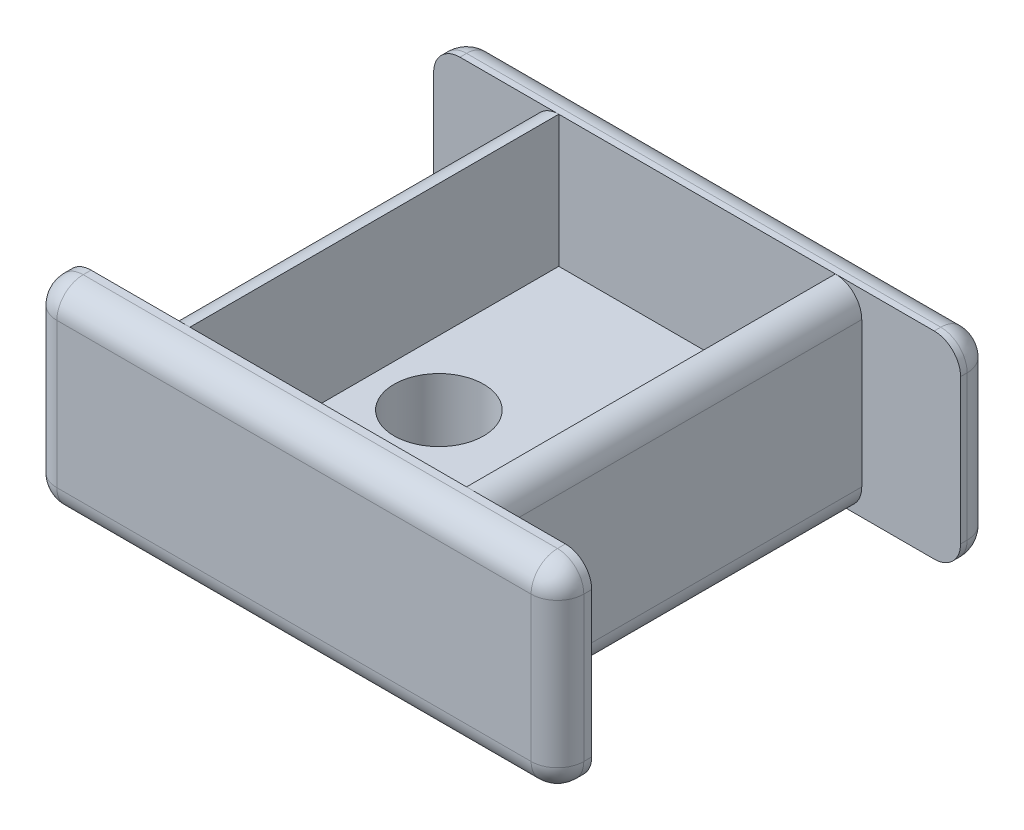
from build123d import *

# Parameters (mm, degrees)
BOSS_EXTRUDE1_DEPTH = 19.05
SKETCH4_R           = 4.064
SKETCH4_R_2         = 4.318
CUT_EXTRUDE3_DEPTH  = 38.1
FILLET8_R           = 2.54
FILLET9_R           = 2.54
SKETCH9_W           = 26.67
SKETCH9_H           = 35.56
CUT_EXTRUDE6_DEPTH  = 12.7
BOSS_EXTRUDE2_DEPTH = 0.254


with BuildPart() as part:
    # Sketch1 → Boss-Extrude1 (new body)
    with BuildSketch(Plane(origin=(0, 0, 0), x_dir=(1, 0, 0), z_dir=(0, 1, 0))):
        Polygon((25.4, 20.955), (-25.4, 20.955), (-25.4, 17.78), (-15.875, 17.78), (-15.875, -17.78), (-25.4, -17.78), (-25.4, -21.082), (25.4, -21.082), (25.4, -17.78), (15.875, -17.78), (15.875, 17.78), (25.4, 17.78), align=None)
    extrude(amount=BOSS_EXTRUDE1_DEPTH)

    # Sketch4 → Cut-Extrude3 (cut)
    with BuildSketch(Plane(origin=(0, 19.05, 0), x_dir=(1, 0, 0), z_dir=(0, 1, 0))):
        with Locations(Location((6.985, 0, 0), (0, 0, 270))):
            Circle(SKETCH4_R)
        with Locations(Location((-7.112, 0, 0), (0, 0, 270))):
            Circle(SKETCH4_R_2)
    extrude(amount=-CUT_EXTRUDE3_DEPTH, mode=Mode.SUBTRACT)

    # Fillet8
    fillet8_edges = [part.edges().sort_by_distance(p)[0] for p in [
        (15.875, 0, 0),
        (0, 0, 21.082),
        (-15.875, 0, 0),
        (0, 0, -20.955),
        (-15.875, 19.05, 0),
        (0, 19.05, 21.082),
        (15.875, 19.05, 0),
        (0, 19.05, -20.955),
    ]]
    fillet(fillet8_edges, radius=FILLET8_R)

    # Fillet9
    fillet9_edges = [part.edges().sort_by_distance(p)[0] for p in [
        (-25.4, 0, 18.161),
        (25.4, 0, -18.0975),
        (-25.4, 19.05, 18.161),
        (25.4, 19.05, -18.0975),
        (-25.4, 9.525, -20.955),
        (25.4, 9.525, -20.955),
        (-25.4, 0, -18.0975),
        (-25.4, 19.05, -18.0975),
        (-25.4, 18.306051224, -20.211051224),
        (-25.4, 0.743948776, -20.211051224),
        (25.4, 0, 18.161),
        (25.4, 18.306051224, -20.211051224),
        (25.4, 0.743948776, -20.211051224),
        (25.4, 9.525, 21.082),
        (-25.4, 9.525, 21.082),
        (25.4, 19.05, 18.161),
        (25.4, 18.306051224, 20.338051224),
        (25.4, 0.743948776, 20.338051224),
        (-25.4, 18.306051224, 20.338051224),
        (-25.4, 0.743948776, 20.338051224),
    ]]
    fillet(fillet9_edges, radius=FILLET9_R)

    # Sketch9 → Cut-Extrude6 (cut)
    with BuildSketch(Plane(origin=(0, 19.05, 0), x_dir=(1, 0, 0), z_dir=(0, 1, 0))):
        Rectangle(SKETCH9_W, SKETCH9_H)
    extrude(amount=-CUT_EXTRUDE6_DEPTH, mode=Mode.SUBTRACT)

    # Sketch10 → Boss-Extrude2 (add)
    # profile 1 of 6: a face of its own
    with BuildSketch(Plane.ZY.offset(15.875)):
        with BuildLine():
            Line((-12.428218361, 9.878456619), (-12.428218361, 8.364943106))
            Line((-12.428218361, 8.364943106), (-12.208729341, 8.364943106))
            add(Edge.make_bspline(
                [(-12.208729341, 8.364943106), (-12.180616558, 8.365690265), (-12.125673568, 8.367150495), (-12.045658699, 8.377427278), (-11.970309821, 8.39514739), (-11.899982609, 8.420349213), (-11.834121009, 8.452287921), (-11.773429787, 8.491629768), (-11.717332866, 8.537958281), (-11.665938638, 8.591911368), (-11.618331766, 8.653794358), (-11.574984177, 8.724337959), (-11.534888519, 8.803496713), (-11.49830777, 8.891239191), (-11.464954173, 8.987736915), (-11.43597942, 9.092802925), (-11.408802352, 9.206306107), (-11.394885674, 9.285428621), (-11.387677821, 9.326408477)],
                knots=[0, 0, 0, 0, 0.962867631, 1.881806797, 2.75778512, 3.609196864, 4.435656485, 5.259527481, 6.080628282, 6.92211412, 7.806505393, 8.7501395, 9.753953683, 10.843121875, 12.003935138, 13.24877583, 14.575060796, 16, 16, 16, 16], degree=3))
            Line((-11.387677821, 9.326408477), (-11.300473429, 9.326408477))
            Line((-11.300473429, 9.326408477), (-11.300473429, 7.318490403))
            Line((-11.300473429, 7.318490403), (-11.392850963, 7.318490403))
            add(Edge.make_bspline(
                [(-11.392850963, 7.318490403), (-11.39934008, 7.359704496), (-11.411706859, 7.438249171), (-11.435525947, 7.548337221), (-11.460098596, 7.645587806), (-11.488669104, 7.730405829), (-11.520332587, 7.807052079), (-11.556424835, 7.878255468), (-11.598518009, 7.945075297), (-11.630935932, 7.986097142), (-11.647073936, 8.006518275)],
                knots=[0, 0, 0, 0, 1.347106059, 2.567277364, 3.636273155, 4.584709308, 5.454914307, 6.312371043, 7.159879461, 8, 8, 8, 8], degree=3))
            add(Edge.make_bspline(
                [(-11.647073936, 8.006518275), (-11.665269253, 8.027726126), (-11.70111357, 8.069505057), (-11.763799725, 8.122939975), (-11.831002075, 8.16938286), (-11.905054217, 8.206337121), (-11.984666097, 8.235214658), (-12.070123871, 8.256005672), (-12.161363743, 8.267532579), (-12.223971322, 8.269394963), (-12.256026638, 8.270348511)],
                knots=[0, 0, 0, 0, 0.973810499, 1.918382085, 2.864985682, 3.818434723, 4.797467574, 5.814959202, 6.881250899, 8, 8, 8, 8], degree=3))
            Line((-12.256026638, 8.270348511), (-12.428218361, 8.270348511))
            Line((-12.428218361, 8.270348511), (-12.428218361, 7.205420302))
            add(Edge.make_bspline(
                [(-12.428218361, 7.205420302), (-12.427873479, 7.179290217), (-12.427204981, 7.128641254), (-12.419767609, 7.055234451), (-12.407248462, 6.987042322), (-12.390202895, 6.924027973), (-12.369430061, 6.865753484), (-12.341274281, 6.813719758), (-12.309705217, 6.766148121), (-12.273199639, 6.723451461), (-12.231408506, 6.68623578), (-12.184450142, 6.65420593), (-12.132109903, 6.627730262), (-12.075033876, 6.605336217), (-12.012482597, 6.588708937), (-11.94532025, 6.576128196), (-11.872891507, 6.568628643), (-11.822978929, 6.567981439), (-11.797095051, 6.567645808)],
                knots=[0, 0, 0, 0, 1.214734356, 2.354567063, 3.426283889, 4.434989608, 5.388249835, 6.29523612, 7.178473649, 8.039518568, 8.899496045, 9.773248569, 10.674938643, 11.621568376, 12.619221065, 13.679675458, 14.796716187, 16, 16, 16, 16], degree=3))
            Line((-11.797095051, 6.567645808), (-11.574649949, 6.567645808))
            Line((-11.574649949, 6.567645808), (-11.574649949, 6.473051214))
            Line((-11.574649949, 6.473051214), (-13.906258902, 6.473051214))
            Line((-13.906258902, 6.473051214), (-13.906258902, 6.567645808))
            Line((-13.906258902, 6.567645808), (-13.81905451, 6.567645808))
            add(Edge.make_bspline(
                [(-13.81905451, 6.567645808), (-13.793173369, 6.568006712), (-13.742775841, 6.568709487), (-13.66982425, 6.575978311), (-13.601975281, 6.588838081), (-13.539112378, 6.605201611), (-13.481801021, 6.627706466), (-13.429388114, 6.654429138), (-13.381870839, 6.685991946), (-13.339975425, 6.723456967), (-13.303762429, 6.766078043), (-13.27144685, 6.813193171), (-13.244185502, 6.865462277), (-13.222781986, 6.923447654), (-13.205984384, 6.986321766), (-13.193476154, 7.054250407), (-13.185954816, 7.127406667), (-13.185309605, 7.177811597), (-13.184975118, 7.203942261)],
                knots=[0, 0, 0, 0, 1.201641854, 2.339919186, 3.39892652, 4.406255795, 5.35159379, 6.25205345, 7.134085744, 7.992889725, 8.852759693, 9.725319925, 10.641197808, 11.582443261, 12.589772536, 13.660026934, 14.786923228, 16, 16, 16, 16], degree=3))
            Line((-13.184975118, 7.203942261), (-13.184975118, 9.242160166))
            add(Edge.make_bspline(
                [(-13.184975118, 9.242160166), (-13.185342493, 9.268285674), (-13.186058036, 9.319170899), (-13.193243266, 9.392883187), (-13.206343648, 9.46108695), (-13.221537637, 9.524467047), (-13.244604502, 9.581724084), (-13.270521186, 9.634591019), (-13.302888777, 9.681391245), (-13.339228301, 9.723451269), (-13.381261436, 9.759897221), (-13.42819623, 9.791735284), (-13.479970566, 9.819453083), (-13.537841292, 9.840612349), (-13.600689392, 9.857454106), (-13.668864901, 9.870015399), (-13.742276501, 9.877440606), (-13.792924779, 9.878110841), (-13.81905451, 9.878456619)],
                knots=[0, 0, 0, 0, 1.211797835, 2.360245289, 3.429371327, 4.43271442, 5.377055753, 6.286743398, 7.158383697, 8.008714094, 8.859044491, 9.730684789, 10.635478509, 11.575731615, 12.581998871, 13.651124909, 14.788202165, 16, 16, 16, 16], degree=3))
            Line((-13.81905451, 9.878456619), (-13.906258902, 9.878456619))
            Line((-13.906258902, 9.878456619), (-13.906258902, 9.973051214))
            Line((-13.906258902, 9.973051214), (-10.07369978, 9.973051214))
            Line((-10.07369978, 9.973051214), (-10.07369978, 8.462493781))
            Line((-10.07369978, 8.462493781), (-10.15573103, 8.462493781))
            add(Edge.make_bspline(
                [(-10.15573103, 8.462493781), (-10.16815866, 8.524958031), (-10.192002131, 8.644801044), (-10.229503377, 8.78891403), (-10.259534232, 8.89335961), (-10.280445786, 8.961003624), (-10.30253496, 9.018620191), (-10.318405844, 9.053285184), (-10.325705693, 9.069229423)],
                knots=[0, 0, 0, 0, 1.815178137, 3.482574705, 4.242659767, 4.913343155, 5.500189807, 6, 6, 6, 6], degree=3))
            add(Edge.make_bspline(
                [(-10.325705693, 9.069229423), (-10.346997579, 9.113642936), (-10.388492147, 9.200197952), (-10.459793096, 9.32160666), (-10.540454033, 9.428866634), (-10.626249156, 9.525419995), (-10.720267531, 9.609592223), (-10.821892508, 9.682603282), (-10.932223194, 9.743367399), (-11.050406574, 9.79302267), (-11.17672221, 9.83151415), (-11.311395658, 9.858348987), (-11.454209315, 9.876092522), (-11.552423531, 9.877655831), (-11.60273272, 9.878456619)],
                knots=[0, 0, 0, 0, 1.098226841, 2.140272995, 3.133547444, 4.086628967, 5.01643607, 5.941818129, 6.871349284, 7.819239113, 8.795890279, 9.810821449, 10.878616558, 12, 12, 12, 12], degree=3))
            Line((-11.60273272, 9.878456619), (-12.428218361, 9.878456619))
        make_face()
    # profile 2 of 6: a face of its own
    with BuildSketch(Plane.ZY.offset(15.875)):
        with BuildLine():
            Line((-9.656153328, 9.973051214), (-7.224776638, 9.973051214))
            Line((-7.224776638, 9.973051214), (-7.224776638, 9.878456619))
            Line((-7.224776638, 9.878456619), (-7.498214138, 9.878456619))
            add(Edge.make_bspline(
                [(-7.498214138, 9.878456619), (-7.523604398, 9.878102746), (-7.573022414, 9.87741399), (-7.644723588, 9.870034668), (-7.711403067, 9.857413564), (-7.773171901, 9.840697366), (-7.829793136, 9.818578977), (-7.881067824, 9.790808976), (-7.928128014, 9.759200366), (-7.969894888, 9.721902653), (-8.006313743, 9.679179775), (-8.038325838, 9.631713892), (-8.06499476, 9.578792199), (-8.086250123, 9.520648235), (-8.103160652, 9.457566517), (-8.115784771, 9.389154752), (-8.123111909, 9.315484931), (-8.123807287, 9.264593671), (-8.124164307, 9.238465065)],
                knots=[0, 0, 0, 0, 1.183666125, 2.3038138, 3.355928178, 4.345281173, 5.283849776, 6.183219152, 7.059401939, 7.921771364, 8.785211201, 9.670905375, 10.585333788, 11.541245421, 12.552756763, 13.62745447, 14.781886972, 16, 16, 16, 16], degree=3))
            Line((-8.124164307, 9.238465065), (-8.124164307, 7.452992092))
            add(Edge.make_bspline(
                [(-8.124164307, 7.452992092), (-8.122508381, 7.403852208), (-8.119288557, 7.308303455), (-8.09299675, 7.170442357), (-8.049939934, 7.043225226), (-7.990167609, 6.926725372), (-7.911903741, 6.823415476), (-7.819811092, 6.731427526), (-7.711391854, 6.653360637), (-7.589071848, 6.587431266), (-7.452530739, 6.536065184), (-7.303471153, 6.499351019), (-7.142438544, 6.476955432), (-7.03098174, 6.474379485), (-6.973509747, 6.473051214)],
                knots=[0, 0, 0, 0, 1.034620493, 2.01174059, 2.943918765, 3.856135388, 4.757062871, 5.663474232, 6.588357472, 7.561278922, 8.582945766, 9.652823849, 10.789693508, 12, 12, 12, 12], degree=3))
            add(Edge.make_bspline(
                [(-6.973509747, 6.473051214), (-6.922228717, 6.474242328), (-6.820861165, 6.476596811), (-6.671717808, 6.493589883), (-6.527981799, 6.522830956), (-6.390828861, 6.562011965), (-6.262777946, 6.611770462), (-6.146976331, 6.670522707), (-6.044818485, 6.738513292), (-5.98654541, 6.792040934), (-5.958095895, 6.81817368)],
                knots=[0, 0, 0, 0, 1.120644207, 2.215184851, 3.275247005, 4.323140333, 5.328904462, 6.272763422, 7.156745323, 8, 8, 8, 8], degree=3))
            add(Edge.make_bspline(
                [(-5.958095895, 6.81817368), (-5.93453439, 6.844503413), (-5.887165344, 6.897437823), (-5.827601297, 6.986872942), (-5.776992926, 7.083796916), (-5.735739638, 7.188093239), (-5.703799525, 7.300262995), (-5.681419144, 7.420004096), (-5.666865154, 7.547475672), (-5.665437084, 7.634995806), (-5.664704848, 7.679871315)],
                knots=[0, 0, 0, 0, 0.907850671, 1.825181402, 2.754749982, 3.716017578, 4.704708414, 5.749775835, 6.846208846, 8, 8, 8, 8], degree=3))
            Line((-5.664704848, 7.679871315), (-5.664704848, 8.939161856))
            add(Edge.make_bspline(
                [(-5.664704848, 8.939161856), (-5.665561141, 8.987493258), (-5.667209174, 9.080512446), (-5.683534308, 9.214179293), (-5.71049035, 9.335855256), (-5.747995485, 9.445419985), (-5.796232733, 9.543379433), (-5.856468008, 9.628654361), (-5.926934611, 9.702932034), (-5.982242913, 9.741151728), (-6.009827314, 9.760213376)],
                knots=[0, 0, 0, 0, 1.245753361, 2.39759167, 3.465474722, 4.453792469, 5.376996215, 6.270462566, 7.137412406, 8, 8, 8, 8], degree=3))
            add(Edge.make_bspline(
                [(-6.009827314, 9.760213376), (-6.042740413, 9.779185873), (-6.108051792, 9.816834103), (-6.199819529, 9.846098779), (-6.280498449, 9.86049873), (-6.352823333, 9.868966029), (-6.437117787, 9.875740235), (-6.497319411, 9.877513103), (-6.529358564, 9.878456619)],
                knots=[0, 0, 0, 0, 1.263201928, 2.506645158, 3.182866477, 3.993341604, 4.932061436, 6, 6, 6, 6], degree=3))
            Line((-6.529358564, 9.878456619), (-6.529358564, 9.973051214))
            Line((-6.529358564, 9.973051214), (-4.839219206, 9.973051214))
            Line((-4.839219206, 9.973051214), (-4.839219206, 9.878456619))
            add(Edge.make_bspline(
                [(-4.839219206, 9.878456619), (-4.864125201, 9.876225863), (-4.911345879, 9.871996446), (-4.977953882, 9.862435697), (-5.03651438, 9.850868266), (-5.105041625, 9.832025402), (-5.187460207, 9.796705011), (-5.246820833, 9.756393995), (-5.278197247, 9.735086687)],
                knots=[0, 0, 0, 0, 0.959871685, 1.819874719, 2.582181741, 3.249919705, 4.546382294, 6, 6, 6, 6], degree=3))
            add(Edge.make_bspline(
                [(-5.278197247, 9.735086687), (-5.300915138, 9.71595603), (-5.346368149, 9.67768021), (-5.405301727, 9.609168491), (-5.45554419, 9.53170047), (-5.497916689, 9.4457621), (-5.53013796, 9.351009655), (-5.553764889, 9.248545956), (-5.56792733, 9.137861972), (-5.56936729, 9.061389125), (-5.570110253, 9.021932126)],
                knots=[0, 0, 0, 0, 0.891296972, 1.783269844, 2.703003498, 3.659672428, 4.65452199, 5.703075205, 6.814876632, 8, 8, 8, 8], degree=3))
            Line((-5.570110253, 9.021932126), (-5.570110253, 7.619271653))
            add(Edge.make_bspline(
                [(-5.570110253, 7.619271653), (-5.571181376, 7.573912582), (-5.573259127, 7.485925563), (-5.58708609, 7.35774874), (-5.611563393, 7.238144585), (-5.644583043, 7.126000571), (-5.688112713, 7.022312652), (-5.741825835, 6.927000056), (-5.804532009, 6.839385589), (-5.854205827, 6.788278207), (-5.879020726, 6.76274716)],
                knots=[0, 0, 0, 0, 1.162756437, 2.255501963, 3.299502036, 4.288422551, 5.247788254, 6.175176988, 7.088397021, 8, 8, 8, 8], degree=3))
            add(Edge.make_bspline(
                [(-5.879020726, 6.76274716), (-5.906335252, 6.737239544), (-5.959964985, 6.687157524), (-6.047760274, 6.624138426), (-6.137331428, 6.570240819), (-6.200384542, 6.543771096), (-6.231533395, 6.530694795)],
                knots=[0, 0, 0, 0, 1.054621979, 2.070659909, 3.046887177, 4, 4, 4, 4], degree=3))
            add(Edge.make_bspline(
                [(-6.231533395, 6.530694795), (-6.265153692, 6.518480726), (-6.333513973, 6.493645813), (-6.440254097, 6.46312609), (-6.551309914, 6.43612161), (-6.667492154, 6.416154847), (-6.787901557, 6.398559471), (-6.913486011, 6.387359607), (-7.043614695, 6.379451002), (-7.131893641, 6.378791602), (-7.176740321, 6.378456619)],
                knots=[0, 0, 0, 0, 0.891566565, 1.812825789, 2.766219052, 3.739639371, 4.75065812, 5.799366071, 6.88205363, 8, 8, 8, 8], degree=3))
            add(Edge.make_bspline(
                [(-7.176740321, 6.378456619), (-7.242786307, 6.379472639), (-7.371846056, 6.381458033), (-7.560658613, 6.396269394), (-7.740124577, 6.421236786), (-7.909358158, 6.456181073), (-8.06666209, 6.501114901), (-8.210724946, 6.554065638), (-8.341174421, 6.615428368), (-8.419494268, 6.6653722), (-8.457462449, 6.689584153)],
                knots=[0, 0, 0, 0, 1.185940103, 2.317432746, 3.398467779, 4.43782573, 5.41793926, 6.333323014, 7.192022255, 8, 8, 8, 8], degree=3))
            add(Edge.make_bspline(
                [(-8.457462449, 6.689584153), (-8.491090041, 6.713684858), (-8.557175992, 6.761048285), (-8.644203109, 6.84434083), (-8.717014539, 6.936266879), (-8.777791576, 7.034899263), (-8.823526917, 7.141953055), (-8.857058188, 7.255976178), (-8.877355584, 7.37812245), (-8.879711814, 7.462274512), (-8.880921064, 7.505462531)],
                knots=[0, 0, 0, 0, 1.032984291, 2.030051666, 2.998193363, 3.956835243, 4.916326676, 5.898092387, 6.921271509, 8, 8, 8, 8], degree=3))
            Line((-8.880921064, 7.505462531), (-8.880921064, 9.238465065))
            add(Edge.make_bspline(
                [(-8.880921064, 9.238465065), (-8.881262263, 9.264349693), (-8.881923436, 9.31450885), (-8.889405017, 9.387170097), (-8.901819532, 9.454957992), (-8.919617545, 9.517712994), (-8.941518831, 9.575905386), (-8.9690724, 9.628583437), (-9.001163971, 9.676504061), (-9.037918231, 9.719716571), (-9.080934915, 9.756873955), (-9.128198299, 9.789501082), (-9.180672341, 9.816942542), (-9.237783001, 9.839911751), (-9.299911096, 9.857784324), (-9.367169201, 9.868744393), (-9.438887473, 9.877794912), (-9.488609027, 9.878231417), (-9.514261436, 9.878456619)],
                knots=[0, 0, 0, 0, 1.202317824, 2.329848042, 3.389451109, 4.400397054, 5.356940965, 6.273334065, 7.155862536, 8.03235821, 8.900216767, 9.78917931, 10.695437472, 11.645522352, 12.645457828, 13.691747676, 14.809123437, 16, 16, 16, 16], degree=3))
            Line((-9.514261436, 9.878456619), (-9.656153328, 9.878456619))
            Line((-9.656153328, 9.878456619), (-9.656153328, 9.973051214))
        make_face()
    # profile 3 of 6: a face of its own
    with BuildSketch(Plane.ZY.offset(15.875)):
        with BuildLine():
            Line((-4.60273272, 9.973051214), (-0.491562956, 9.973051214))
            Line((-0.491562956, 9.973051214), (-0.491562956, 8.194229423))
            Line((-0.491562956, 8.194229423), (-0.571377145, 8.189056281))
            add(Edge.make_bspline(
                [(-0.571377145, 8.189056281), (-0.577394616, 8.243830212), (-0.589233865, 8.3515968), (-0.617681752, 8.509795506), (-0.654387198, 8.662161979), (-0.700271387, 8.808489626), (-0.754374647, 8.949052765), (-0.817245715, 9.083665282), (-0.888714791, 9.212719661), (-0.943257229, 9.294011532), (-0.970448091, 9.3345377)],
                knots=[0, 0, 0, 0, 1.077639742, 2.12023413, 3.141712916, 4.141502564, 5.117814788, 6.085755003, 7.045697765, 8, 8, 8, 8], degree=3))
            add(Edge.make_bspline(
                [(-0.970448091, 9.3345377), (-1.004036276, 9.377924379), (-1.069320184, 9.462253199), (-1.180169051, 9.573287671), (-1.296763202, 9.667841822), (-1.421002553, 9.744801568), (-1.551565251, 9.805516868), (-1.689728229, 9.847140934), (-1.834025091, 9.874417691), (-1.932772098, 9.87709656), (-1.982905861, 9.878456619)],
                knots=[0, 0, 0, 0, 1.100109691, 2.138235824, 3.140287537, 4.105980005, 5.063694346, 6.020604662, 6.995062822, 8, 8, 8, 8], degree=3))
            Line((-1.982905861, 9.878456619), (-2.164704848, 9.878456619))
            Line((-2.164704848, 9.878456619), (-2.164704848, 7.203942261))
            add(Edge.make_bspline(
                [(-2.164704848, 7.203942261), (-2.164350489, 7.178305947), (-2.16366062, 7.128396992), (-2.156282853, 7.055958403), (-2.143649063, 6.988548186), (-2.126974807, 6.926027108), (-2.104640528, 6.868535018), (-2.077234021, 6.816111408), (-2.045526652, 6.767851413), (-2.007418145, 6.726149352), (-1.965484634, 6.688165244), (-1.918096323, 6.655952857), (-1.866046468, 6.628429606), (-1.808964668, 6.606171449), (-1.74711553, 6.588572607), (-1.680077528, 6.576118072), (-1.608393493, 6.568674677), (-1.558973046, 6.567995011), (-1.533581537, 6.567645808)],
                knots=[0, 0, 0, 0, 1.196207752, 2.328785576, 3.39313216, 4.394446538, 5.344550691, 6.265046201, 7.151525482, 8.030893351, 8.894027207, 9.786969363, 10.697284563, 11.636685143, 12.641097023, 13.694144027, 14.815284637, 16, 16, 16, 16], degree=3))
            Line((-1.533581537, 6.567645808), (-1.007399105, 6.567645808))
            Line((-1.007399105, 6.567645808), (-1.007399105, 6.473051214))
            Line((-1.007399105, 6.473051214), (-4.076550287, 6.473051214))
            Line((-4.076550287, 6.473051214), (-4.076550287, 6.567645808))
            Line((-4.076550287, 6.567645808), (-3.554801976, 6.567645808))
            add(Edge.make_bspline(
                [(-3.554801976, 6.567645808), (-3.529163514, 6.567986739), (-3.479495513, 6.568647205), (-3.407570072, 6.576126502), (-3.340518198, 6.588543371), (-3.278496291, 6.60633579), (-3.221044122, 6.628255952), (-3.168770402, 6.655923367), (-3.121435242, 6.688445783), (-3.078726873, 6.725637743), (-3.041463537, 6.768153413), (-3.00963644, 6.816068969), (-2.982219159, 6.868531385), (-2.96013943, 6.926151654), (-2.942263776, 6.988409242), (-2.929961288, 7.055979928), (-2.922484602, 7.12839111), (-2.921808759, 7.178303951), (-2.921461605, 7.203942261)],
                knots=[0, 0, 0, 0, 1.194246268, 2.313548484, 3.364868753, 4.367633646, 5.316179863, 6.225002373, 7.116480325, 7.986794574, 8.857108824, 9.742134499, 10.661120625, 11.609666842, 12.612431735, 13.675033055, 14.805753732, 16, 16, 16, 16], degree=3))
            Line((-2.921461605, 7.203942261), (-2.921461605, 9.878456619))
            Line((-2.921461605, 9.878456619), (-3.146123767, 9.878456619))
            add(Edge.make_bspline(
                [(-3.146123767, 9.878456619), (-3.197012616, 9.876956601), (-3.297138111, 9.874005265), (-3.443156149, 9.844552575), (-3.58184127, 9.798747495), (-3.7135193, 9.734402959), (-3.83756068, 9.651068604), (-3.953043252, 9.548154255), (-4.062992066, 9.429105785), (-4.126136207, 9.338321949), (-4.158581537, 9.291674525)],
                knots=[0, 0, 0, 0, 0.997412868, 1.962442805, 2.910127415, 3.856973432, 4.828914921, 5.832457869, 6.886252656, 8, 8, 8, 8], degree=3))
            add(Edge.make_bspline(
                [(-4.158581537, 9.291674525), (-4.189624817, 9.241973769), (-4.25297096, 9.140555646), (-4.331128055, 8.974494896), (-4.399045212, 8.79541151), (-4.433086212, 8.669509903), (-4.450494544, 8.605124693)],
                knots=[0, 0, 0, 0, 0.93749145, 1.913021675, 2.932733735, 4, 4, 4, 4], degree=3))
            add(Edge.make_bspline(
                [(-4.450494544, 8.605124693), (-4.456119275, 8.579792322), (-4.468627379, 8.523458975), (-4.484255892, 8.429427491), (-4.500530485, 8.317816617), (-4.510293766, 8.237363946), (-4.515528328, 8.194229423)],
                knots=[0, 0, 0, 0, 0.748052937, 1.663497098, 2.747289114, 4, 4, 4, 4], degree=3))
            Line((-4.515528328, 8.194229423), (-4.60273272, 8.194229423))
            Line((-4.60273272, 8.194229423), (-4.60273272, 9.973051214))
        make_face()
    # profile 4 of 6: a face of its own
    with BuildSketch(Plane.ZY.offset(15.875)):
        with BuildLine():
            Line((-0.054801976, 9.973051214), (2.376574713, 9.973051214))
            Line((2.376574713, 9.973051214), (2.376574713, 9.878456619))
            Line((2.376574713, 9.878456619), (2.103137213, 9.878456619))
            add(Edge.make_bspline(
                [(2.103137213, 9.878456619), (2.077746953, 9.878102746), (2.028328938, 9.87741399), (1.956627763, 9.870034668), (1.889948285, 9.857413564), (1.82817945, 9.840697366), (1.771558215, 9.818578977), (1.720283528, 9.790808976), (1.673223338, 9.759200366), (1.631456464, 9.721902653), (1.595037608, 9.679179775), (1.563025514, 9.631713892), (1.536356592, 9.578792199), (1.515101229, 9.520648235), (1.498190699, 9.457566517), (1.48556658, 9.389154752), (1.478239442, 9.315484931), (1.477544065, 9.264593671), (1.477187044, 9.238465065)],
                knots=[0, 0, 0, 0, 1.183666125, 2.3038138, 3.355928178, 4.345281173, 5.283849776, 6.183219152, 7.059401939, 7.921771364, 8.785211201, 9.670905375, 10.585333788, 11.541245421, 12.552756763, 13.62745447, 14.781886972, 16, 16, 16, 16], degree=3))
            Line((1.477187044, 9.238465065), (1.477187044, 7.452992092))
            add(Edge.make_bspline(
                [(1.477187044, 7.452992092), (1.478842971, 7.403852208), (1.482062794, 7.308303455), (1.508354601, 7.170442357), (1.551411417, 7.043225226), (1.611183742, 6.926725372), (1.689447611, 6.823415476), (1.781540259, 6.731427526), (1.889959497, 6.653360637), (2.012279504, 6.587431266), (2.148820612, 6.536065184), (2.297880198, 6.499351019), (2.458912808, 6.476955432), (2.570369611, 6.474379485), (2.627841605, 6.473051214)],
                knots=[0, 0, 0, 0, 1.034620493, 2.01174059, 2.943918765, 3.856135388, 4.757062871, 5.663474232, 6.588357472, 7.561278922, 8.582945766, 9.652823849, 10.789693508, 12, 12, 12, 12], degree=3))
            add(Edge.make_bspline(
                [(2.627841605, 6.473051214), (2.679122634, 6.474242328), (2.780490187, 6.476596811), (2.929633544, 6.493589883), (3.073369552, 6.522830956), (3.21052249, 6.562011965), (3.338573405, 6.611770462), (3.454375021, 6.670522707), (3.556532867, 6.738513292), (3.614805941, 6.792040934), (3.643255456, 6.81817368)],
                knots=[0, 0, 0, 0, 1.120644207, 2.215184851, 3.275247005, 4.323140333, 5.328904462, 6.272763422, 7.156745323, 8, 8, 8, 8], degree=3))
            add(Edge.make_bspline(
                [(3.643255456, 6.81817368), (3.666816961, 6.844503413), (3.714186007, 6.897437823), (3.773750054, 6.986872942), (3.824358425, 7.083796916), (3.865611713, 7.188093239), (3.897551826, 7.300262995), (3.919932208, 7.420004096), (3.934486197, 7.547475672), (3.935914268, 7.634995806), (3.936646503, 7.679871315)],
                knots=[0, 0, 0, 0, 0.907850671, 1.825181402, 2.754749982, 3.716017578, 4.704708414, 5.749775835, 6.846208846, 8, 8, 8, 8], degree=3))
            Line((3.936646503, 7.679871315), (3.936646503, 8.939161856))
            add(Edge.make_bspline(
                [(3.936646503, 8.939161856), (3.93579021, 8.987493258), (3.934142178, 9.080512446), (3.917817043, 9.214179293), (3.890861002, 9.335855256), (3.853355867, 9.445419985), (3.805118618, 9.543379433), (3.744883344, 9.628654361), (3.67441674, 9.702932034), (3.619108439, 9.741151728), (3.591524037, 9.760213376)],
                knots=[0, 0, 0, 0, 1.245753361, 2.39759167, 3.465474722, 4.453792469, 5.376996215, 6.270462566, 7.137412406, 8, 8, 8, 8], degree=3))
            add(Edge.make_bspline(
                [(3.591524037, 9.760213376), (3.558610938, 9.779185873), (3.493299559, 9.816834103), (3.401531822, 9.846098779), (3.320852902, 9.86049873), (3.248528018, 9.868966029), (3.164233564, 9.875740235), (3.10403194, 9.877513103), (3.071992787, 9.878456619)],
                knots=[0, 0, 0, 0, 1.263201928, 2.506645158, 3.182866477, 3.993341604, 4.932061436, 6, 6, 6, 6], degree=3))
            Line((3.071992787, 9.878456619), (3.071992787, 9.973051214))
            Line((3.071992787, 9.973051214), (4.762132145, 9.973051214))
            Line((4.762132145, 9.973051214), (4.762132145, 9.878456619))
            add(Edge.make_bspline(
                [(4.762132145, 9.878456619), (4.73722615, 9.876225863), (4.690005472, 9.871996446), (4.623397469, 9.862435697), (4.564836971, 9.850868266), (4.496309726, 9.832025402), (4.413891145, 9.796705011), (4.354530518, 9.756393995), (4.323154105, 9.735086687)],
                knots=[0, 0, 0, 0, 0.959871685, 1.819874719, 2.582181741, 3.249919705, 4.546382294, 6, 6, 6, 6], degree=3))
            add(Edge.make_bspline(
                [(4.323154105, 9.735086687), (4.300436213, 9.71595603), (4.254983202, 9.67768021), (4.196049624, 9.609168491), (4.145807161, 9.53170047), (4.103434663, 9.4457621), (4.071213391, 9.351009655), (4.047586463, 9.248545956), (4.033424021, 9.137861972), (4.031984061, 9.061389125), (4.031241098, 9.021932126)],
                knots=[0, 0, 0, 0, 0.891296972, 1.783269844, 2.703003498, 3.659672428, 4.65452199, 5.703075205, 6.814876632, 8, 8, 8, 8], degree=3))
            Line((4.031241098, 9.021932126), (4.031241098, 7.619271653))
            add(Edge.make_bspline(
                [(4.031241098, 7.619271653), (4.030169976, 7.573912582), (4.028092225, 7.485925563), (4.014265261, 7.35774874), (3.989787959, 7.238144585), (3.956768309, 7.126000571), (3.913238638, 7.022312652), (3.859525517, 6.927000056), (3.796819342, 6.839385589), (3.747145525, 6.788278207), (3.722330625, 6.76274716)],
                knots=[0, 0, 0, 0, 1.162756437, 2.255501963, 3.299502036, 4.288422551, 5.247788254, 6.175176988, 7.088397021, 8, 8, 8, 8], degree=3))
            add(Edge.make_bspline(
                [(3.722330625, 6.76274716), (3.695016099, 6.737239544), (3.641386367, 6.687157524), (3.553591077, 6.624138426), (3.464019923, 6.570240819), (3.400966809, 6.543771096), (3.369817956, 6.530694795)],
                knots=[0, 0, 0, 0, 1.054621979, 2.070659909, 3.046887177, 4, 4, 4, 4], degree=3))
            add(Edge.make_bspline(
                [(3.369817956, 6.530694795), (3.336197659, 6.518480726), (3.267837378, 6.493645813), (3.161097254, 6.46312609), (3.050041437, 6.43612161), (2.933859197, 6.416154847), (2.813449794, 6.398559471), (2.687865341, 6.387359607), (2.557736656, 6.379451002), (2.469457711, 6.378791602), (2.42461103, 6.378456619)],
                knots=[0, 0, 0, 0, 0.891566565, 1.812825789, 2.766219052, 3.739639371, 4.75065812, 5.799366071, 6.88205363, 8, 8, 8, 8], degree=3))
            add(Edge.make_bspline(
                [(2.42461103, 6.378456619), (2.358565044, 6.379472639), (2.229505295, 6.381458033), (2.040692738, 6.396269394), (1.861226774, 6.421236786), (1.691993193, 6.456181073), (1.534689261, 6.501114901), (1.390626405, 6.554065638), (1.26017693, 6.615428368), (1.181857083, 6.6653722), (1.143888902, 6.689584153)],
                knots=[0, 0, 0, 0, 1.185940103, 2.317432746, 3.398467779, 4.43782573, 5.41793926, 6.333323014, 7.192022255, 8, 8, 8, 8], degree=3))
            add(Edge.make_bspline(
                [(1.143888902, 6.689584153), (1.11026131, 6.713684858), (1.044175359, 6.761048285), (0.957148242, 6.84434083), (0.884336812, 6.936266879), (0.823559776, 7.034899263), (0.777824435, 7.141953055), (0.744293163, 7.255976178), (0.723995767, 7.37812245), (0.721639538, 7.462274512), (0.720430287, 7.505462531)],
                knots=[0, 0, 0, 0, 1.032984291, 2.030051666, 2.998193363, 3.956835243, 4.916326676, 5.898092387, 6.921271509, 8, 8, 8, 8], degree=3))
            Line((0.720430287, 7.505462531), (0.720430287, 9.238465065))
            add(Edge.make_bspline(
                [(0.720430287, 9.238465065), (0.720089089, 9.264349693), (0.719427915, 9.31450885), (0.711946335, 9.387170097), (0.699531819, 9.454957992), (0.681733806, 9.517712994), (0.65983252, 9.575905386), (0.632278951, 9.628583437), (0.60018738, 9.676504061), (0.56343312, 9.719716571), (0.520416436, 9.756873955), (0.473153052, 9.789501082), (0.42067901, 9.816942542), (0.363568351, 9.839911751), (0.301440256, 9.857784324), (0.234182151, 9.868744393), (0.162463879, 9.877794912), (0.112742325, 9.878231417), (0.087089916, 9.878456619)],
                knots=[0, 0, 0, 0, 1.202317824, 2.329848042, 3.389451109, 4.400397054, 5.356940965, 6.273334065, 7.155862536, 8.03235821, 8.900216767, 9.78917931, 10.695437472, 11.645522352, 12.645457828, 13.691747676, 14.809123437, 16, 16, 16, 16], degree=3))
            Line((0.087089916, 9.878456619), (-0.054801976, 9.878456619))
            Line((-0.054801976, 9.878456619), (-0.054801976, 9.973051214))
        make_face()
    # profile 5 of 6: a face of its own
    with BuildSketch(Plane.ZY.offset(15.875)):
        with BuildLine():
            Line((7.374568801, 8.175753916), (6.585295152, 8.175753916))
            Line((6.585295152, 8.175753916), (6.585295152, 7.20098618))
            add(Edge.make_bspline(
                [(6.585295152, 7.20098618), (6.58562387, 7.175100492), (6.586257746, 7.125184425), (6.593850224, 7.05278001), (6.606118797, 6.985467453), (6.623884529, 6.923145166), (6.646322148, 6.865855468), (6.672234159, 6.812749297), (6.705688853, 6.766114821), (6.74248827, 6.723386117), (6.785105215, 6.686232264), (6.832776642, 6.654195723), (6.885856552, 6.627734912), (6.943663916, 6.605326848), (7.006723646, 6.58881866), (7.074580112, 6.575984032), (7.147529528, 6.568707919), (7.197927366, 6.568006179), (7.223808666, 6.567645808)],
                knots=[0, 0, 0, 0, 1.201621739, 2.317119521, 3.376109128, 4.375465689, 5.320787859, 6.231420348, 7.110465611, 7.97782172, 8.845177828, 9.727195358, 10.637827846, 11.593817963, 12.601130375, 13.660119983, 14.798378261, 16, 16, 16, 16], degree=3))
            Line((7.223808666, 6.567645808), (7.327271503, 6.567645808))
            Line((7.327271503, 6.567645808), (7.327271503, 6.473051214))
            Line((7.327271503, 6.473051214), (5.100603429, 6.473051214))
            Line((5.100603429, 6.473051214), (5.100603429, 6.567645808))
            Line((5.100603429, 6.567645808), (5.195198024, 6.567645808))
            add(Edge.make_bspline(
                [(5.195198024, 6.567645808), (5.221079104, 6.568006802), (5.271476513, 6.568709754), (5.344428939, 6.575977338), (5.412275026, 6.588841385), (5.475147834, 6.60519022), (5.532425296, 6.627745356), (5.5847741, 6.65420035), (5.631717667, 6.686243518), (5.673558757, 6.723426304), (5.709745462, 6.766086385), (5.742068261, 6.8131908), (5.769327563, 6.865462944), (5.790731659, 6.923447459), (5.807529091, 6.986321824), (5.820037371, 7.05425039), (5.827558695, 7.127406671), (5.828203907, 7.177811599), (5.828538395, 7.203942261)],
                knots=[0, 0, 0, 0, 1.202353652, 2.341305248, 3.40093989, 4.408865861, 5.354763831, 6.255756882, 7.128833979, 7.988146677, 8.848525993, 9.721603089, 10.638023497, 11.579826501, 12.587752472, 13.65864084, 14.786204657, 16, 16, 16, 16], degree=3))
            Line((5.828538395, 7.203942261), (5.828538395, 9.242160166))
            add(Edge.make_bspline(
                [(5.828538395, 9.242160166), (5.828204874, 9.268292446), (5.827555268, 9.31919086), (5.81991054, 9.392767029), (5.808405526, 9.461309632), (5.791687157, 9.524324263), (5.76903744, 9.581779124), (5.742844291, 9.634333771), (5.711462769, 9.681621601), (5.674973931, 9.723417824), (5.633004934, 9.759906421), (5.586052404, 9.791732691), (5.534283073, 9.819453817), (5.476410918, 9.840612133), (5.413563237, 9.857454169), (5.345387605, 9.87001538), (5.271976041, 9.877440612), (5.221327757, 9.878110843), (5.195198024, 9.878456619)],
                knots=[0, 0, 0, 0, 1.212213306, 2.361054512, 3.428529135, 4.435141395, 5.3798065, 6.289806035, 7.155352303, 8.00597424, 8.856596177, 9.728535322, 10.633639255, 11.574214732, 12.580826992, 13.650319585, 14.787786694, 16, 16, 16, 16], degree=3))
            Line((5.195198024, 9.878456619), (5.100603429, 9.878456619))
            Line((5.100603429, 9.878456619), (5.100603429, 9.973051214))
            Line((5.100603429, 9.973051214), (7.812807821, 9.973051214))
            add(Edge.make_bspline(
                [(7.812807821, 9.973051214), (7.857644579, 9.972732653), (7.944869877, 9.972112926), (8.072003668, 9.96832684), (8.192029702, 9.962677753), (8.304682996, 9.95400599), (8.410128833, 9.942021407), (8.508460192, 9.928009939), (8.599844107, 9.912300351), (8.70968063, 9.88684275), (8.835833762, 9.848821667), (8.972520098, 9.787131266), (9.094572305, 9.713054023), (9.162214808, 9.650068061), (9.195514747, 9.619060504)],
                knots=[0, 0, 0, 0, 1.1026507, 2.145093463, 3.127710445, 4.057454617, 4.923156212, 5.737071024, 6.500013756, 7.202472385, 8.509293697, 9.732155867, 10.883555914, 12, 12, 12, 12], degree=3))
            add(Edge.make_bspline(
                [(9.195514747, 9.619060504), (9.212437475, 9.600684338), (9.246602219, 9.563585298), (9.290420999, 9.50125909), (9.329240725, 9.434219252), (9.361836576, 9.363036831), (9.389560072, 9.289932532), (9.408396067, 9.215768336), (9.421193098, 9.142096972), (9.422488868, 9.092930721), (9.42313299, 9.068490403)],
                knots=[0, 0, 0, 0, 0.982726558, 1.983994524, 2.992191763, 4.029367408, 5.063590783, 6.065797937, 7.038517031, 8, 8, 8, 8], degree=3))
            add(Edge.make_bspline(
                [(9.42313299, 9.068490403), (9.422166576, 9.03611435), (9.420260026, 8.972242585), (9.400032448, 8.879300706), (9.368981047, 8.791254868), (9.325555025, 8.707883535), (9.26874134, 8.630228657), (9.199783331, 8.557300258), (9.118952499, 8.488717521), (9.057817241, 8.44947968), (9.026279105, 8.429237869)],
                knots=[0, 0, 0, 0, 0.983034381, 1.939338918, 2.877490213, 3.815551803, 4.786411914, 5.793214062, 6.861574848, 8, 8, 8, 8], degree=3))
            add(Edge.make_bspline(
                [(9.026279105, 8.429237869), (8.999150114, 8.415222612), (8.941358565, 8.385366602), (8.844774462, 8.34797645), (8.735037606, 8.311653449), (8.571688979, 8.26736787), (8.358774234, 8.221234173), (8.184997118, 8.201206495), (8.098808666, 8.191273342)],
                knots=[0, 0, 0, 0, 0.570533791, 1.215379956, 1.933391765, 2.731167072, 4.378752872, 6, 6, 6, 6], degree=3))
            add(Edge.make_bspline(
                [(8.098808666, 8.191273342), (8.081077255, 8.189956819), (8.04366706, 8.187179185), (7.984262013, 8.184571898), (7.918509923, 8.181354973), (7.846073981, 8.179223947), (7.766988312, 8.177994191), (7.681268561, 8.176270253), (7.589131968, 8.175610899), (7.525575264, 8.175705269), (7.492812044, 8.175753916)],
                knots=[0, 0, 0, 0, 0.703745394, 1.484780516, 2.353474026, 3.309495962, 4.35300933, 5.484265384, 6.703149161, 8, 8, 8, 8], degree=3))
            Line((7.492812044, 8.175753916), (7.492812044, 8.166146653))
            add(Edge.make_bspline(
                [(7.492812044, 8.166146653), (7.525522829, 8.145371291), (7.588939759, 8.105093761), (7.682000835, 8.047891955), (7.770696471, 7.996836561), (7.882127882, 7.937027464), (8.019292801, 7.872470616), (8.158331958, 7.816468274), (8.273098862, 7.777670048), (8.365087325, 7.751592684), (8.462286102, 7.725457738), (8.529359381, 7.709963681), (8.563652416, 7.702041923)],
                knots=[0, 0, 0, 0, 0.989780157, 1.918902832, 2.789874643, 3.60340579, 5.148610692, 6.659367881, 7.429397497, 8.241832945, 9.10108937, 10, 10, 10, 10], degree=3))
            Line((8.563652416, 7.702041923), (8.645683666, 7.577147498))
            add(Edge.make_bspline(
                [(8.645683666, 7.577147498), (8.658358691, 7.558499358), (8.681942478, 7.523801694), (8.713094681, 7.474534699), (8.741281018, 7.434270348), (8.770141865, 7.387025533), (8.807966021, 7.330521935), (8.838097781, 7.285002164), (8.854087382, 7.260846822)],
                knots=[0, 0, 0, 0, 1.071377605, 1.993458873, 2.769399216, 3.405936679, 4.623444599, 6, 6, 6, 6], degree=3))
            add(Edge.make_bspline(
                [(8.854087382, 7.260846822), (8.876366131, 7.226513568), (8.919585133, 7.159909786), (8.984876522, 7.064310795), (9.048030252, 6.975523224), (9.109991362, 6.895177282), (9.166814558, 6.822777008), (9.221463578, 6.763647287), (9.267929738, 6.71333065), (9.29994727, 6.686841309), (9.31449701, 6.674803748)],
                knots=[0, 0, 0, 0, 1.313652749, 2.548381848, 3.715725439, 4.810091755, 5.805397304, 6.667583828, 7.394509569, 8, 8, 8, 8], degree=3))
            add(Edge.make_bspline(
                [(9.31449701, 6.674803748), (9.328344137, 6.666068705), (9.356850735, 6.648086178), (9.404465383, 6.627470278), (9.455732709, 6.608743405), (9.51128117, 6.593223224), (9.571330621, 6.581457516), (9.635570017, 6.573767261), (9.704109167, 6.568178737), (9.751245371, 6.567827584), (9.775645659, 6.567645808)],
                knots=[0, 0, 0, 0, 0.817553247, 1.68306836, 2.58708467, 3.546472698, 4.56351669, 5.643721884, 6.780261055, 8, 8, 8, 8], degree=3))
            Line((9.775645659, 6.567645808), (9.872457314, 6.567645808))
            Line((9.872457314, 6.567645808), (9.872457314, 6.473051214))
            Line((9.872457314, 6.473051214), (8.588779105, 6.473051214))
            Line((8.588779105, 6.473051214), (7.374568801, 8.175753916))
        make_face()
        with BuildLine():
            Line((6.585295152, 8.270348511), (7.585928598, 8.270348511))
            add(Edge.make_bspline(
                [(7.585928598, 8.270348511), (7.642380444, 8.271199214), (7.750369268, 8.272826554), (7.904457803, 8.28889955), (8.042564062, 8.315888092), (8.165568853, 8.352984539), (8.273232548, 8.402862163), (8.366891658, 8.463520001), (8.44590774, 8.53605188), (8.50985829, 8.620795712), (8.560106409, 8.717309815), (8.593993177, 8.826974362), (8.616158944, 8.948368261), (8.618078469, 9.033648908), (8.619078936, 9.078097666)],
                knots=[0, 0, 0, 0, 1.350300784, 2.58304035, 3.700758403, 4.712992955, 5.649061865, 6.530153912, 7.372652008, 8.201327671, 9.058053739, 9.96203005, 10.937798454, 12, 12, 12, 12], degree=3))
            add(Edge.make_bspline(
                [(8.619078936, 9.078097666), (8.618575892, 9.110422837), (8.617596381, 9.173365345), (8.604083742, 9.264233679), (8.5857096, 9.34952073), (8.557470746, 9.428199995), (8.520808824, 9.5003888), (8.477302723, 9.566921478), (8.424773924, 9.626229243), (8.365121628, 9.680275278), (8.296851442, 9.727275176), (8.220824108, 9.768273755), (8.136620788, 9.802017522), (8.04461229, 9.829962437), (7.944818473, 9.852116025), (7.837069117, 9.867141588), (7.72160436, 9.877127077), (7.641870462, 9.878003948), (7.600709003, 9.878456619)],
                knots=[0, 0, 0, 0, 1.04759633, 2.039845137, 2.974223105, 3.874064963, 4.742488356, 5.595779195, 6.445244775, 7.305318815, 8.200892624, 9.126929757, 10.101876705, 11.138257986, 12.24337251, 13.414170929, 14.66510355, 16, 16, 16, 16], degree=3))
            Line((7.600709003, 9.878456619), (6.585295152, 9.878456619))
            Line((6.585295152, 9.878456619), (6.585295152, 8.270348511))
        make_face(mode=Mode.SUBTRACT)
    # profile 6 of 6: a face of its own
    with BuildSketch(Plane.ZY.offset(15.875)):
        with BuildLine():
            Line((10.114116943, 9.973051214), (13.840996166, 9.973051214))
            Line((13.840996166, 9.973051214), (13.840996166, 8.62212216))
            Line((13.840996166, 8.62212216), (13.766355118, 8.62212216))
            add(Edge.make_bspline(
                [(13.766355118, 8.62212216), (13.749852216, 8.677378782), (13.718880952, 8.781079784), (13.67193341, 8.924872732), (13.628012842, 9.046672036), (13.584963463, 9.149256379), (13.539284576, 9.239340336), (13.490247178, 9.324097903), (13.434257633, 9.406233283), (13.392753628, 9.458213737), (13.371718294, 9.484558815)],
                knots=[0, 0, 0, 0, 1.447635074, 2.716800271, 3.796716971, 4.69722576, 5.507540922, 6.330592663, 7.153899913, 8, 8, 8, 8], degree=3))
            add(Edge.make_bspline(
                [(13.371718294, 9.484558815), (13.345701257, 9.513955258), (13.295028646, 9.57120984), (13.211194984, 9.645330513), (13.123642037, 9.706665278), (13.061042267, 9.736626879), (13.030290929, 9.751345133)],
                knots=[0, 0, 0, 0, 1.076868837, 2.097385523, 3.065364924, 4, 4, 4, 4], degree=3))
            add(Edge.make_bspline(
                [(13.030290929, 9.751345133), (13.004042941, 9.761512207), (12.950832548, 9.782123083), (12.867797447, 9.807603736), (12.780888086, 9.830282364), (12.689437564, 9.847400317), (12.59408552, 9.861770434), (12.494644771, 9.871000305), (12.391114652, 9.877105428), (12.320594347, 9.878000177), (12.284619476, 9.878456619)],
                knots=[0, 0, 0, 0, 0.887292397, 1.798735042, 2.736925273, 3.717963014, 4.73077341, 5.776497595, 6.865713758, 8, 8, 8, 8], degree=3))
            Line((12.284619476, 9.878456619), (11.598808666, 9.878456619))
            Line((11.598808666, 9.878456619), (11.598808666, 8.223051214))
            Line((11.598808666, 8.223051214), (11.782824713, 8.223051214))
            add(Edge.make_bspline(
                [(11.782824713, 8.223051214), (11.816417492, 8.22383246), (11.882090898, 8.225359787), (11.977677735, 8.24361073), (12.068542814, 8.270085576), (12.153328946, 8.310235515), (12.233199236, 8.360025338), (12.307731835, 8.421108478), (12.375890783, 8.494353013), (12.416204236, 8.54902985), (12.436857652, 8.577041923)],
                knots=[0, 0, 0, 0, 1.036941302, 2.027205501, 2.997955775, 3.955233612, 4.916530786, 5.901246421, 6.924765152, 8, 8, 8, 8], degree=3))
            add(Edge.make_bspline(
                [(12.436857652, 8.577041923), (12.457083707, 8.60839275), (12.498183103, 8.672097712), (12.546504111, 8.777530989), (12.589788783, 8.890301393), (12.61032827, 8.969952283), (12.620873699, 9.010846822)],
                knots=[0, 0, 0, 0, 0.943942363, 1.918093296, 2.931102794, 4, 4, 4, 4], degree=3))
            add(Edge.make_bspline(
                [(12.620873699, 9.010846822), (12.626035187, 9.030748389), (12.637432998, 9.074695856), (12.650436395, 9.147688183), (12.665178742, 9.233006992), (12.67242421, 9.29433805), (12.67630022, 9.327147498)],
                knots=[0, 0, 0, 0, 0.767407356, 1.694620835, 2.766722441, 4, 4, 4, 4], degree=3))
            Line((12.67630022, 9.327147498), (12.763504612, 9.327147498))
            Line((12.763504612, 9.327147498), (12.763504612, 7.031750538))
            Line((12.763504612, 7.031750538), (12.67630022, 7.031750538))
            add(Edge.make_bspline(
                [(12.67630022, 7.031750538), (12.665783752, 7.09172753), (12.645315802, 7.208459311), (12.612244706, 7.350175301), (12.585538878, 7.456148571), (12.5620444, 7.526352374), (12.539096117, 7.589402471), (12.504571423, 7.663648688), (12.454509847, 7.75206069), (12.406287236, 7.817561798), (12.381431132, 7.851324018)],
                knots=[0, 0, 0, 0, 1.657533368, 3.22601746, 3.961354312, 4.631593595, 5.240758324, 5.786964186, 6.859301734, 8, 8, 8, 8], degree=3))
            add(Edge.make_bspline(
                [(12.381431132, 7.851324018), (12.362270667, 7.873538164), (12.324377163, 7.917470912), (12.258227833, 7.973665479), (12.187445135, 8.022148836), (12.109795756, 8.061099763), (12.026292862, 8.090888351), (11.937068595, 8.113562754), (11.841794811, 8.125806897), (11.776452154, 8.127557957), (11.742917618, 8.128456619)],
                knots=[0, 0, 0, 0, 0.975144931, 1.928536682, 2.879138924, 3.825203998, 4.810840928, 5.825052962, 6.883794419, 8, 8, 8, 8], degree=3))
            Line((11.742917618, 8.128456619), (11.598808666, 8.128456619))
            Line((11.598808666, 8.128456619), (11.598808666, 6.567645808))
            Line((11.598808666, 6.567645808), (12.172288395, 6.567645808))
            add(Edge.make_bspline(
                [(12.172288395, 6.567645808), (12.213679939, 6.568075796), (12.294302075, 6.568913322), (12.411978108, 6.575275402), (12.523083138, 6.587562081), (12.628312663, 6.602470426), (12.727793577, 6.623211254), (12.821715406, 6.649229018), (12.910813912, 6.679220943), (12.994867014, 6.715159143), (13.075638337, 6.755934604), (13.152792036, 6.803489878), (13.228138416, 6.855933568), (13.275422799, 6.89517454), (13.299294307, 6.914985335)],
                knots=[0, 0, 0, 0, 1.234440084, 2.404433048, 3.512687447, 4.567263271, 5.572981436, 6.540794094, 7.47243388, 8.374402339, 9.264807393, 10.168210871, 11.075221716, 12, 12, 12, 12], degree=3))
            add(Edge.make_bspline(
                [(13.299294307, 6.914985335), (13.338654174, 6.950785045), (13.41740054, 7.022408687), (13.519144178, 7.146620722), (13.608765933, 7.282440783), (13.654980301, 7.381391134), (13.678411706, 7.431560504)],
                knots=[0, 0, 0, 0, 0.986861948, 1.974391658, 2.972984996, 4, 4, 4, 4], degree=3))
            add(Edge.make_bspline(
                [(13.678411706, 7.431560504), (13.69167905, 7.463746985), (13.720034112, 7.532536159), (13.760796095, 7.644516265), (13.800814207, 7.77255256), (13.827129724, 7.863343938), (13.840996166, 7.91118466)],
                knots=[0, 0, 0, 0, 0.824292771, 1.761684315, 2.820563783, 4, 4, 4, 4], degree=3))
            Line((13.840996166, 7.91118466), (13.933373699, 7.91118466))
            Line((13.933373699, 7.91118466), (13.933373699, 6.473051214))
            Line((13.933373699, 6.473051214), (10.118551064, 6.473051214))
            Line((10.118551064, 6.473051214), (10.114116943, 6.567645808))
            Line((10.114116943, 6.567645808), (10.208711537, 6.567645808))
            add(Edge.make_bspline(
                [(10.208711537, 6.567645808), (10.234363978, 6.567870977), (10.284085593, 6.568307418), (10.355803438, 6.577358386), (10.423063022, 6.588316899), (10.485185986, 6.606194871), (10.542314436, 6.629145361), (10.5947261, 6.656652456), (10.642349356, 6.689135652), (10.684510271, 6.727164978), (10.722343062, 6.769666296), (10.753614813, 6.818213779), (10.781524584, 6.87089255), (10.803186342, 6.928936262), (10.821388559, 6.991577481), (10.833459477, 7.059448533), (10.841072551, 7.132327527), (10.841718544, 7.182490029), (10.842051909, 7.208376383)],
                knots=[0, 0, 0, 0, 1.190227921, 2.306995074, 3.352715033, 4.352105868, 5.30167326, 6.207437804, 7.09591615, 7.970888068, 8.838273924, 9.729840082, 10.645734044, 11.601756948, 12.601147783, 13.671420971, 14.798337049, 16, 16, 16, 16], degree=3))
            Line((10.842051909, 7.208376383), (10.842051909, 9.242899187))
            add(Edge.make_bspline(
                [(10.842051909, 9.242899187), (10.841718387, 9.269031465), (10.84106878, 9.319929878), (10.833424059, 9.39350606), (10.821919022, 9.462048616), (10.805200729, 9.525063406), (10.782550752, 9.582517723), (10.756358515, 9.63507427), (10.724973791, 9.682355432), (10.68849658, 9.724175871), (10.646483969, 9.760573629), (10.599794429, 9.792686939), (10.547394629, 9.819030875), (10.490261181, 9.841857675), (10.426905003, 9.85710279), (10.358933218, 9.870121551), (10.285480692, 9.877411299), (10.234838255, 9.878100867), (10.208711537, 9.878456619)],
                knots=[0, 0, 0, 0, 1.212525589, 2.361662751, 3.42941237, 4.436283947, 5.381192411, 6.291426374, 7.157195618, 8.008036687, 8.858877756, 9.731041525, 10.631092045, 11.576000509, 12.579946166, 13.649714276, 14.787474411, 16, 16, 16, 16], degree=3))
            Line((10.208711537, 9.878456619), (10.114116943, 9.878456619))
            Line((10.114116943, 9.878456619), (10.114116943, 9.973051214))
        make_face()
    extrude(amount=BOSS_EXTRUDE2_DEPTH)


solid = part.part
